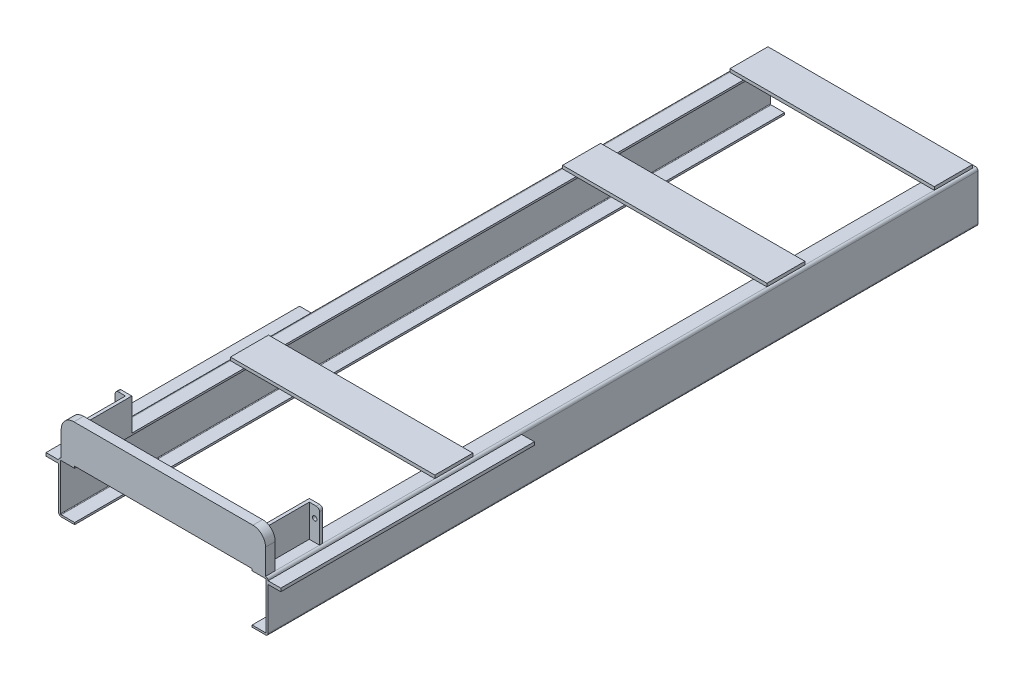
from build123d import *

# Parameters (mm, degrees)
EXTRUDE_THIN1_DEPTH  = 1400
SKETCH3_W            = 50
SKETCH3_H            = 12.5
BOSS_EXTRUDE1_DEPTH  = 1000
BOSS_EXTRUDE2_DEPTH  = 38
SKETCH5_W            = 806
SKETCH5_H            = 150
BOSS_EXTRUDE3_DEPTH  = 12.5
LPATTERN1_COUNT      = 2
LPATTERN1_PITCH      = 660
LPATTERN2_COUNT      = 2
LPATTERN2_PITCH      = 1970
SKETCH6_W            = 12.5
SKETCH6_H            = 127
BOSS_EXTRUDE4_DEPTH  = 175
SKETCH7_W            = 53
SKETCH7_H            = 127
SKETCH7_R            = 8.75
BOSS_EXTRUDE5_DEPTH  = 12.5
FILLET1_R            = 12.5
FILLET1_OF_MIRROR3_R = 12.5


with BuildPart() as part:
    # Sketch1 → Extrude-Thin1 (new, symmetric)
    with BuildSketch(Plane.XY):
        with BuildLine():
            Line((350, 100), (403, 100))
            ThreePointArc((403, 100), (410.071067812, 97.071067812), (413, 90))
            Line((413, 90), (413, -90))
            ThreePointArc((413, -90), (410.071067812, -97.071067812), (403, -100))
            Line((403, -100), (350, -100))
            Line((350, -100), (350, -92.5))
            Line((350, -92.5), (403, -92.5))
            ThreePointArc((403, -92.5), (404.767766953, -91.767766953), (405.5, -90))
            Line((405.5, -90), (405.5, 90))
            ThreePointArc((405.5, 90), (404.767766953, 91.767766953), (403, 92.5))
            Line((403, 92.5), (350, 92.5))
            Line((350, 92.5), (350, 100))
        make_face()
    extrude(amount=EXTRUDE_THIN1_DEPTH, both=True)

    # Sketch3 → Boss-Extrude1 (add)
    with BuildSketch(Plane.XY.offset(1400)):
        with Locations((438, 83.75)):
            Rectangle(SKETCH3_W, SKETCH3_H)
    extrude(amount=-BOSS_EXTRUDE1_DEPTH)


with BuildPart() as body_2:
    # Mirror2: mirrored copy
    add(part.part.mirror(Plane(origin=(0, 0, 0), x_dir=(0, 0, 1), z_dir=(1, 0, 0))))


with BuildPart() as part_1:
    add(part.part)

    add(body_2.part)  # Boss-Extrude2 merges body 2
    # Sketch4 → Boss-Extrude2 (add)
    with BuildSketch(Plane.XY.offset(1400)):
        with BuildLine():
            Line((-403, 100), (403, 100))
            Line((403, 100), (403, 200))
            ThreePointArc((403, 200), (388.355339059, 235.355339059), (353, 250))
            Line((353, 250), (-353, 250))
            ThreePointArc((-353, 250), (-388.355339059, 235.355339059), (-403, 200))
            Line((-403, 200), (-403, 100))
        make_face()
    extrude(amount=-BOSS_EXTRUDE2_DEPTH)

    # Sketch5 → Boss-Extrude3 (add)
    with BuildSketch(Plane(origin=(0, 100, 0), x_dir=(1, 0, 0), z_dir=(0, 1, 0))):
        with Locations((0, 1312.5)):
            Rectangle(SKETCH5_W, SKETCH5_H)
    boss_extrude3 = extrude(amount=BOSS_EXTRUDE3_DEPTH)

    # LPattern1: Boss-Extrude3 ×2
    with Locations(*[(0, 0, i * LPATTERN1_PITCH) for i in range(1, LPATTERN1_COUNT)]):
        add(boss_extrude3)

    # LPattern2: Boss-Extrude3 ×2
    with Locations(*[(0, 0, i * LPATTERN2_PITCH) for i in range(1, LPATTERN2_COUNT)]):
        add(boss_extrude3)

    # Sketch6 → Boss-Extrude4 (add)
    with BuildSketch(Plane(origin=(0, 0, 1362), x_dir=(-1, 0, 0), z_dir=(0, 0, -1))):
        with Locations((-356.25, 163.5)):
            Rectangle(SKETCH6_W, SKETCH6_H)
    boss_extrude4 = extrude(amount=BOSS_EXTRUDE4_DEPTH)

    # Sketch7 → Boss-Extrude5 (add)
    with BuildSketch(Plane(origin=(0, 0, 1187), x_dir=(-1, 0, 0), z_dir=(0, 0, -1))):
        with Locations((-376.5, 163.5)):
            Rectangle(SKETCH7_W, SKETCH7_H)
        with Locations((-384, 182)):
            Circle(SKETCH7_R, mode=Mode.SUBTRACT)
    boss_extrude5 = extrude(amount=BOSS_EXTRUDE5_DEPTH)

    # Fillet1
    fillet1_edges = [part_1.edges().sort_by_distance(p)[0] for p in [
        (403, 227, 1180.75),
    ]]
    fillet(fillet1_edges, radius=FILLET1_R)

    # Mirror3: Boss-Extrude4, Boss-Extrude5 across plane
    add(boss_extrude4.mirror(Plane(origin=(0, 0, 0), x_dir=(0, 0, 1), z_dir=(1, 0, 0))))
    add(boss_extrude5.mirror(Plane(origin=(0, 0, 0), x_dir=(0, 0, 1), z_dir=(1, 0, 0))))

    # Fillet1 of Mirror3
    fillet1_of_mirror3_edges = [part_1.edges().sort_by_distance(p)[0] for p in [
        (-403, 227, 1180.75),
    ]]
    fillet(fillet1_of_mirror3_edges, radius=FILLET1_OF_MIRROR3_R)


solid = part_1.part
